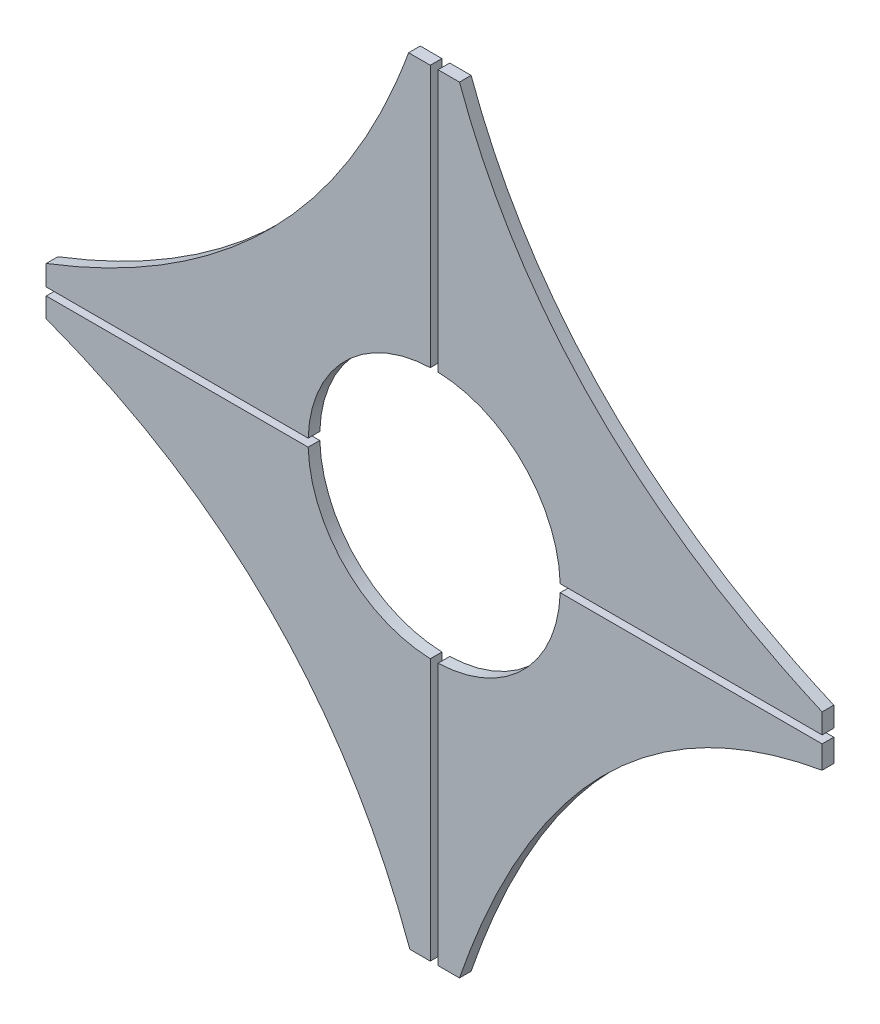
from build123d import *

# Parameters (mm, degrees)
ESBO_O2_W                = 200
ESBO_O2_H                = 200
RESSALTO_EXTRUS_O1_DEPTH = 3
ESBO_O3_R                = 32.5
CORTE_EXTRUS_O1_DEPTH    = 10
ESBO_O4_W                = 2
ESBO_O4_H                = 77.62520767
CORTE_EXTRUS_O2_DEPTH    = 10
CORTE_EXTRUS_O3_DEPTH    = 10
CORTE_EXTRUS_O4_DEPTH    = 10
CORTE_EXTRUS_O5_DEPTH    = 10
CORTE_EXTRUS_O6_DEPTH    = 10


with BuildPart() as part:
    # Esboço2 → Ressalto-extrusão1 (new body)
    with BuildSketch(Plane.XY):
        with Locations((17.290717504, 28.474677087)):
            Rectangle(ESBO_O2_W, ESBO_O2_H)
    extrude(amount=RESSALTO_EXTRUS_O1_DEPTH)

    # Esboço3 → Corte-extrusão1 (cut)
    with BuildSketch(Plane.XY.offset(3)):
        with Locations((17.290717504, 28.474677087)):
            Circle(ESBO_O3_R)
    extrude(amount=-CORTE_EXTRUS_O1_DEPTH, mode=Mode.SUBTRACT)

    # Esboço4 → Corte-extrusão2 (cut)
    with BuildSketch(Plane.XY.offset(3)):
        Polygon((17.290717504, 53.3052203), (16.290717504, 53.3052203), (16.290717504, 128.474677087), (18.290717504, 128.474677087), (18.290717504, 53.3052203), align=None)
        Polygon((38.802998825, 29.474677087), (117.290717504, 29.474677087), (117.290717504, 27.474677087), (38.802998825, 27.474677087), (38.802998825, 28.474677087), align=None)
        with Locations((17.290717504, -32.712719078)):
            Rectangle(ESBO_O4_W, ESBO_O4_H)
        Polygon((-7.924461031, 27.474677087), (-82.709282496, 27.474677087), (-82.709282496, 28.474677087), (-82.709282496, 29.474677087), (-7.924461031, 29.474677087), align=None)
    extrude(amount=-CORTE_EXTRUS_O2_DEPTH, mode=Mode.SUBTRACT)


with BuildPart() as corte_extrus_o2_piece_1:
    # of the separate pieces the step leaves, piece 1, a body of its own (corte_extrus_o2_pieces)
    add(part.part.solids().sort_by_distance((-82.709282496, 128.474677087, 0))[0])

    # Esboço6 → Corte-extrusão4 (cut)
    with BuildSketch(Plane.XY.offset(3)):
        with BuildLine():
            Line((-82.709282496, 34.730552493), (-82.709282496, 128.474677087))
            Line((-82.709282496, 128.474677087), (10.701800736, 128.474677087))
            add(Edge.make_bspline(
                [(-82.709282496, 34.730552493), (-13.804566508, 61.143986452), (10.701800736, 128.474677087)],
                knots=[0, 0, 0, 1, 1, 1], degree=2))
        make_face()
    extrude(amount=-CORTE_EXTRUS_O4_DEPTH, mode=Mode.SUBTRACT)


with BuildPart() as corte_extrus_o2_piece_2:
    # of the separate pieces the step leaves, piece 2, a body of its own (corte_extrus_o2_pieces)
    add(part.part.solids().sort_by_distance((18.290717504, 128.474677087, 0))[0])

    # Esboço5 → Corte-extrusão3 (cut)
    with BuildSketch(Plane.XY.offset(3)):
        with BuildLine():
            Line((23.809769713, 128.474677087), (117.290717504, 128.474677087))
            Line((117.290717504, 128.474677087), (117.290717504, 34.624726341))
            add(Edge.make_bspline(
                [(23.809769713, 128.474677087), (46.745640535, 65.458889909), (117.290717504, 34.624726341)],
                knots=[0, 0, 0, 1, 1, 1], degree=2))
        make_face()
    extrude(amount=-CORTE_EXTRUS_O3_DEPTH, mode=Mode.SUBTRACT)


with BuildPart() as corte_extrus_o2_piece_3:
    # of the separate pieces the step leaves, piece 3, a body of its own (corte_extrus_o2_pieces)
    add(part.part.solids().sort_by_distance((49.775329246, 27.474677087, 0))[0])

    # Esboço7 → Corte-extrusão5 (cut)
    with BuildSketch(Plane.XY.offset(3)):
        with BuildLine():
            Line((23.809769713, -71.525322913), (117.290717504, -71.525322913))
            Line((117.290717504, -71.525322913), (117.290717504, 21.586621923))
            add(Edge.make_bspline(
                [(117.290717504, 21.586621923), (51.851674106, 10.04795298), (23.809769713, -71.525322913)],
                knots=[0, 0, 0, 1, 1, 1], degree=2))
        make_face()
    extrude(amount=-CORTE_EXTRUS_O5_DEPTH, mode=Mode.SUBTRACT)


with BuildPart() as corte_extrus_o2_piece_4:
    # of the separate pieces the step leaves, piece 4, a body of its own (corte_extrus_o2_pieces)
    add(part.part.solids().sort_by_distance((-82.709282496, -71.525322913, 0))[0])

    # Esboço8 → Corte-extrusão6 (cut)
    with BuildSketch(Plane.XY.offset(3)):
        with BuildLine():
            Line((-82.709282496, 22.324627834), (-82.709282496, -71.525322913))
            Line((-82.709282496, -71.525322913), (11.017667266, -71.525322913))
            add(Edge.make_bspline(
                [(-82.709282496, 22.324627834), (-13.824211925, -3.272820778), (11.017667266, -71.525322913)],
                knots=[0, 0, 0, 1, 1, 1], degree=2))
        make_face()
    extrude(amount=-CORTE_EXTRUS_O6_DEPTH, mode=Mode.SUBTRACT)


solid = Compound([corte_extrus_o2_piece_1.part, corte_extrus_o2_piece_2.part, corte_extrus_o2_piece_3.part, corte_extrus_o2_piece_4.part])
